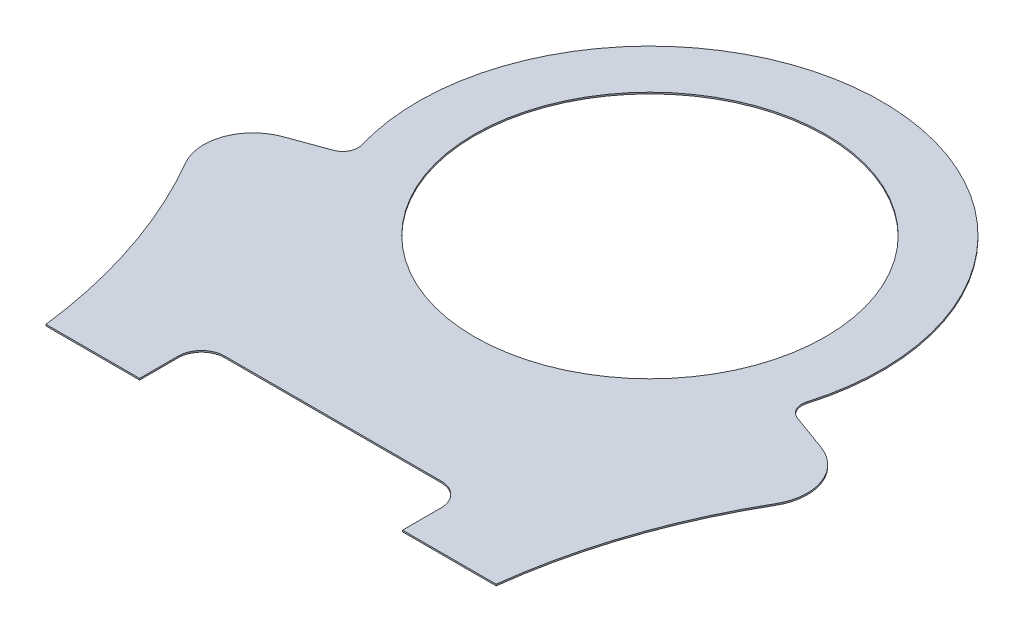
from build123d import *

# Parameters (mm, degrees)
SKETCH26_R          = 11.35
BOSS_EXTRUDE1_DEPTH = 0.096


with BuildPart() as part:
    # Sketch26 → Boss-Extrude1 (new body)
    with BuildSketch(Plane(origin=(0, 0, 0), x_dir=(-1, 0, 0), z_dir=(0, 1, 0))):
        with BuildLine():
            Line((-17.412906679, 6.337779723), (-15.005687805, 5.461623706))
            ThreePointArc((-15.005687805, 5.461623706), (-14.455056516, 4.972678709), (-14.388476201, 4.239310392))
            ThreePointArc((-14.388476201, 4.239310392), (-12.012278216, -8.983605738), (0, -15))
            ThreePointArc((0, -15), (12.012278216, -8.983605738), (14.388476201, 4.239310392))
            ThreePointArc((14.388476201, 4.239310392), (14.455056516, 4.972678709), (15.005687805, 5.461623706))
            Line((15.005687805, 5.461623706), (17.412906679, 6.337779723))
            ThreePointArc((17.412906679, 6.337779723), (19.324147584, 8.250755696), (19.084800719, 10.944272346))
            ThreePointArc((19.084800719, 10.944272346), (16.129508637, 17.491581777), (14.553727529, 24.5))
            Line((14.553727529, 24.5), (8.5, 24.5))
            Line((8.5, 24.5), (8.5, 22))
            ThreePointArc((8.5, 22), (8.060660172, 20.939339828), (7, 20.5))
            Line((7, 20.5), (-7, 20.5))
            ThreePointArc((-7, 20.5), (-8.060660172, 20.939339828), (-8.5, 22))
            Line((-8.5, 22), (-8.5, 24.5))
            Line((-8.5, 24.5), (-14.553727529, 24.5))
            ThreePointArc((-14.553727529, 24.5), (-16.129508637, 17.491581777), (-19.084800719, 10.944272346))
            ThreePointArc((-19.084800719, 10.944272346), (-19.324147584, 8.250755696), (-17.412906679, 6.337779723))
        make_face()
        with Locations(Location((0, 0, 0), (0, 0, 90))):
            Circle(SKETCH26_R, mode=Mode.SUBTRACT)
    extrude(amount=BOSS_EXTRUDE1_DEPTH)


solid = part.part
